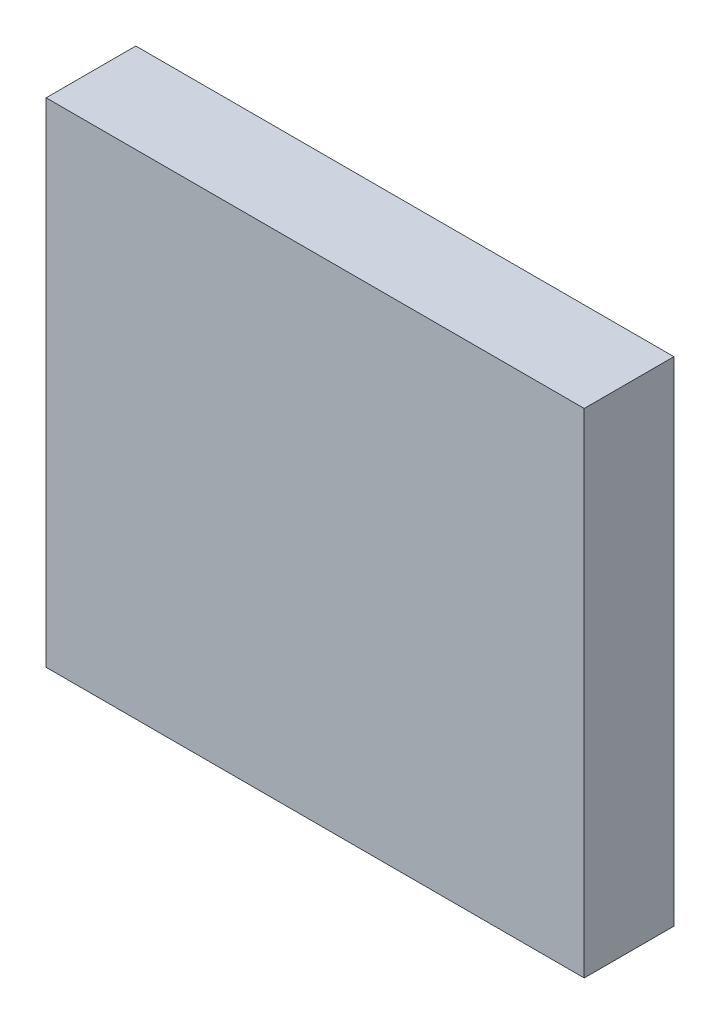
from build123d import *

# Parameters (mm, degrees)
SKETCH_1_W      = 30
SKETCH_1_H      = 27.5
EXTRUDE_1_DEPTH = 5


with BuildPart() as part:
    # 草图1 → 凸台-拉伸1 (new body)
    with BuildSketch(Plane.XY):
        Rectangle(SKETCH_1_W, SKETCH_1_H)
    extrude(amount=EXTRUDE_1_DEPTH)


solid = part.part
